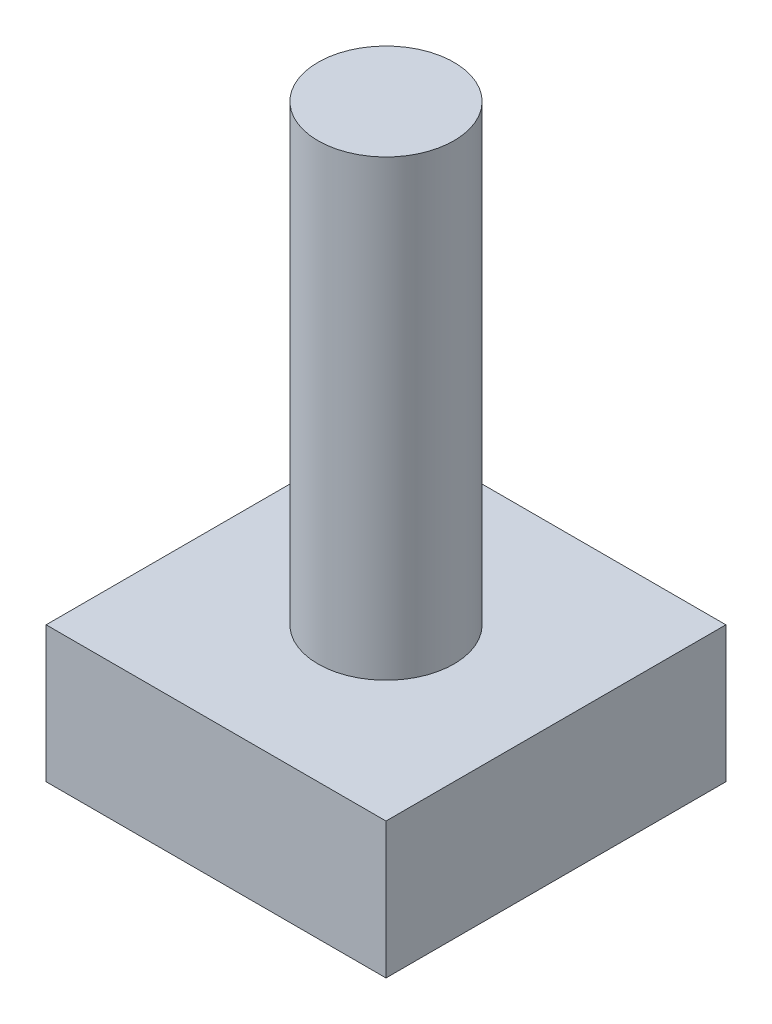
from build123d import *

# Parameters (mm, degrees)
SKETCH1_W           = 15
SKETCH1_H           = 15
BOSS_EXTRUDE1_DEPTH = 6
SKETCH2_R           = 3
BOSS_EXTRUDE2_DEPTH = 20


with BuildPart() as part:
    # Sketch1 → Boss-Extrude1 (new body)
    with BuildSketch(Plane(origin=(0, 0, 0), x_dir=(1, 0, 0), z_dir=(0, 1, 0))):
        with Locations((7.5, 7.5)):
            Rectangle(SKETCH1_W, SKETCH1_H)
    extrude(amount=BOSS_EXTRUDE1_DEPTH)

    # Sketch2 → Boss-Extrude2 (add)
    with BuildSketch(Plane(origin=(0, 6, 0), x_dir=(1, 0, 0), z_dir=(0, 1, 0))):
        with Locations(Location((7.5, 7.5, 0), (0, 0, 270))):
            Circle(SKETCH2_R)
    extrude(amount=BOSS_EXTRUDE2_DEPTH)


solid = part.part
